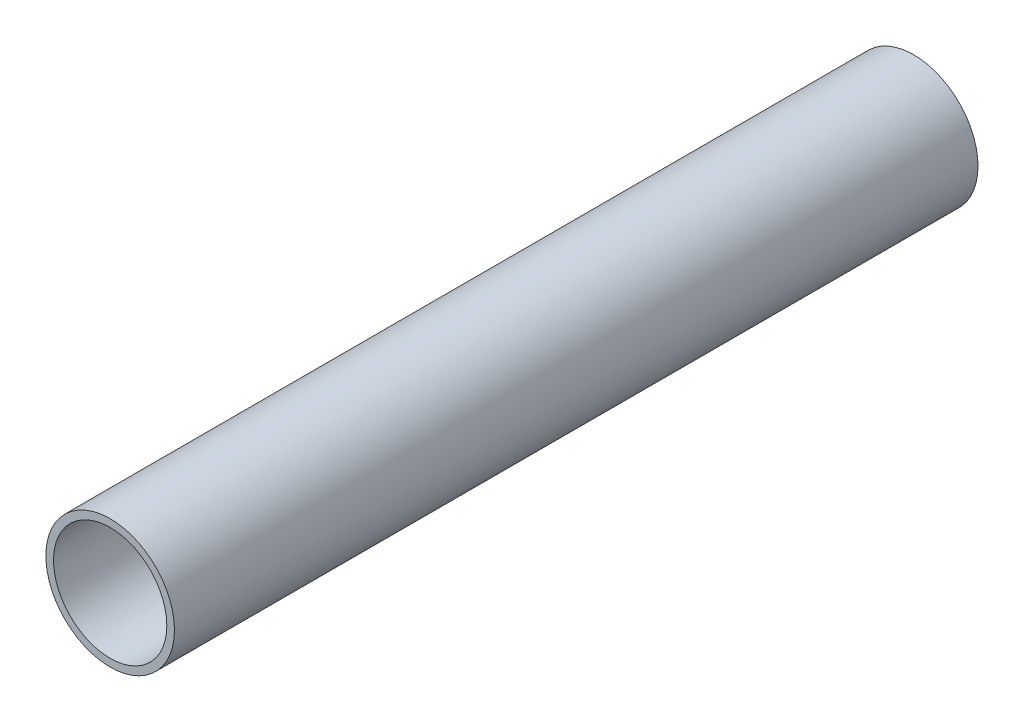
from build123d import *

# Parameters (mm, degrees)
PIPESKETCH_R    = 16
PIPESKETCH_R_2  = 14.1
EXTRUSION_DEPTH = 200


with BuildPart() as part:
    # PipeSketch → Extrusion (new body)
    with BuildSketch(Plane.XY):
        Circle(PIPESKETCH_R)
        Circle(PIPESKETCH_R_2, mode=Mode.SUBTRACT)
    extrude(amount=EXTRUSION_DEPTH)


solid = part.part
